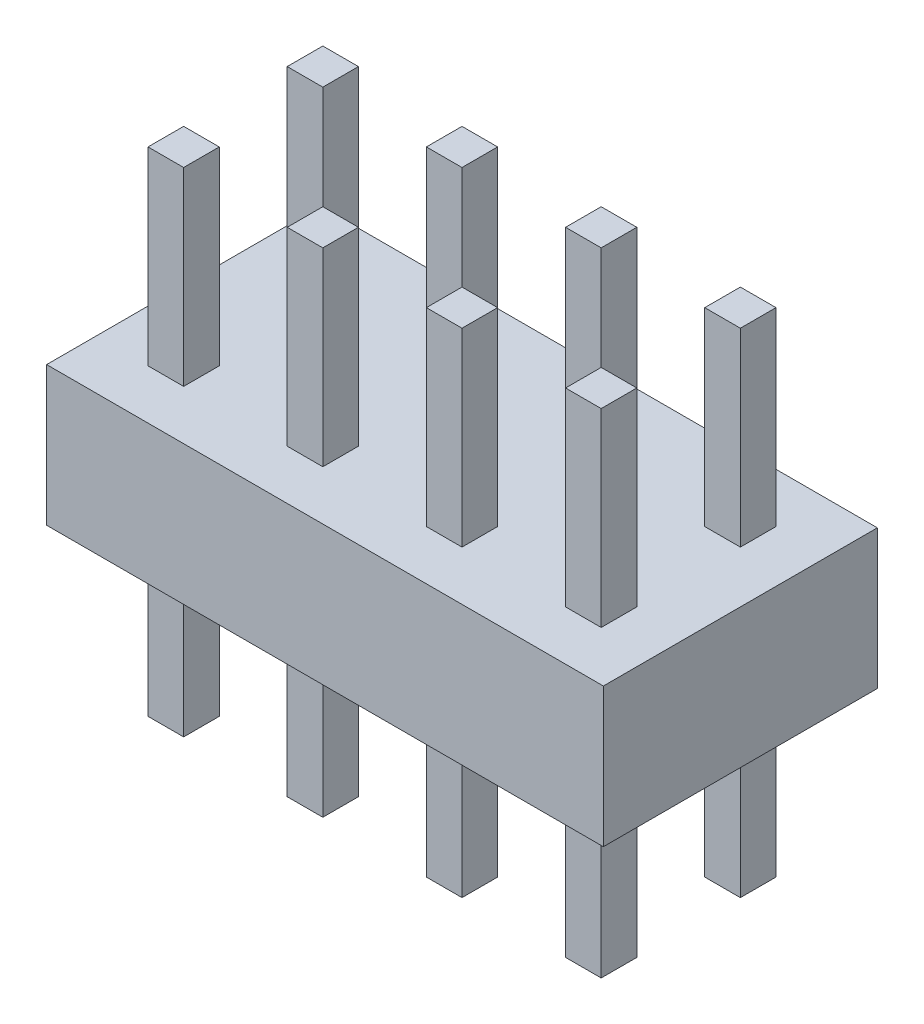
from build123d import *

# Parameters (mm, degrees)
SKETCH1_W           = 10.16
SKETCH1_H           = 5
SKETCH1_W_2         = 0.65
SKETCH1_H_2         = 0.65
BOSS_EXTRUDE1_DEPTH = 2.54
SKETCH2_W           = 0.65
SKETCH2_H           = 0.65
BOSS_EXTRUDE2_DEPTH = 9


with BuildPart() as part:
    # Sketch1 → Boss-Extrude1 (new body)
    with BuildSketch(Plane(origin=(0, 0, 0), x_dir=(1, 0, 0), z_dir=(0, 1, 0))):
        with Locations((5.08, 2.5)):
            Rectangle(SKETCH1_W, SKETCH1_H)
        with Locations((1.27, 3.77)):
            Rectangle(SKETCH1_W_2, SKETCH1_H_2, mode=Mode.SUBTRACT)
        with Locations((1.27, 1.23)):
            Rectangle(SKETCH1_W_2, SKETCH1_H_2, mode=Mode.SUBTRACT)
        with Locations((3.81, 3.77)):
            Rectangle(SKETCH1_W_2, SKETCH1_H_2, mode=Mode.SUBTRACT)
        with Locations((6.35, 3.77)):
            Rectangle(SKETCH1_W_2, SKETCH1_H_2, mode=Mode.SUBTRACT)
        with Locations((8.89, 3.77)):
            Rectangle(SKETCH1_W_2, SKETCH1_H_2, mode=Mode.SUBTRACT)
        with Locations((3.81, 1.23)):
            Rectangle(SKETCH1_W_2, SKETCH1_H_2, mode=Mode.SUBTRACT)
        with Locations((6.35, 1.23)):
            Rectangle(SKETCH1_W_2, SKETCH1_H_2, mode=Mode.SUBTRACT)
        with Locations((8.89, 1.23)):
            Rectangle(SKETCH1_W_2, SKETCH1_H_2, mode=Mode.SUBTRACT)
    extrude(amount=BOSS_EXTRUDE1_DEPTH)

    # Sketch2 → Boss-Extrude2 (add)
    with BuildSketch(Plane(origin=(0, -3, 0), x_dir=(-1, 0, 0), z_dir=(0, -1, 0))):
        with Locations((-8.89, 3.77)):
            Rectangle(SKETCH2_W, SKETCH2_H)
        with Locations((-6.35, 1.23)):
            Rectangle(SKETCH2_W, SKETCH2_H)
        with Locations((-6.35, 3.77)):
            Rectangle(SKETCH2_W, SKETCH2_H)
        with Locations((-3.81, 1.23)):
            Rectangle(SKETCH2_W, SKETCH2_H)
        with Locations((-3.81, 3.77)):
            Rectangle(SKETCH2_W, SKETCH2_H)
        with Locations((-1.27, 1.23)):
            Rectangle(SKETCH2_W, SKETCH2_H)
        with Locations((-8.89, 1.23)):
            Rectangle(SKETCH2_W, SKETCH2_H)
        with Locations((-1.27, 3.77)):
            Rectangle(SKETCH2_W, SKETCH2_H)
    extrude(amount=-BOSS_EXTRUDE2_DEPTH)


solid = part.part
